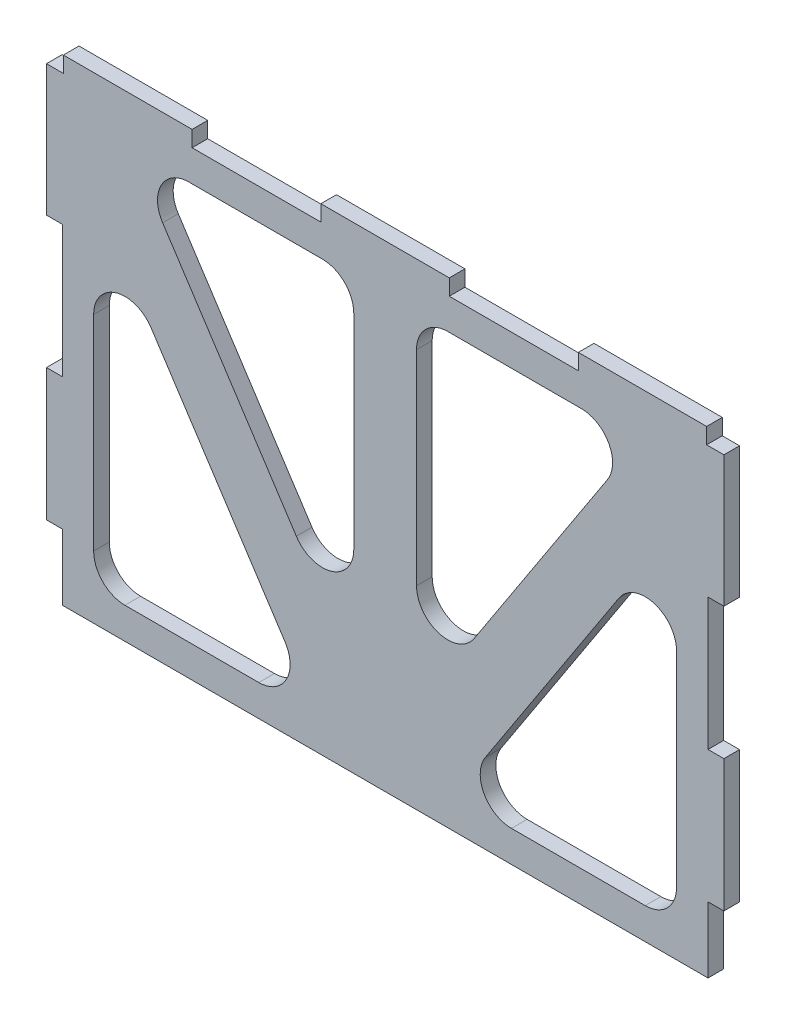
from build123d import *

# Parameters (mm, degrees)
BOSS_EXTRUDE1_DEPTH = 10


with BuildPart() as part:
    # Sketch1 → Boss-Extrude1 (new body)
    with BuildSketch(Plane.XY):
        Polygon((-237.234601608, -129.63585579), (-237.234601608, -87.457773568), (-247.40109201, -87.457773568), (-247.40109201, -3.101609123), (-237.234601608, -3.101609123), (-237.234601608, 81.254555321), (-247.40109201, 81.254555321), (-247.40109201, 165.110720504), (-236.605829759, 165.110720504), (-236.605829759, 175.291552649), (-154.294832327, 175.291552649), (-154.294832327, 165.110720504), (-71.987006932, 165.110720504), (-71.987006932, 175.291552649), (10.110681918, 175.291552649), (10.110681918, 165.110720504), (92.609794057, 165.110720504), (92.609794057, 175.291552649), (174.626730953, 175.291552649), (174.626730953, 165.110720504), (185.669445552, 165.110720504), (185.669445552, 81.254555321), (175.502955151, 81.254555321), (175.502955151, -3.101609123), (185.669445552, -3.101609123), (185.669445552, -87.457773568), (175.502955151, -87.457773568), (175.502955151, -129.63585579), align=None)
        with BuildLine():
            Line((-50.938162507, 125.110720504), (-50.938162507, -5.688963776))
            ThreePointArc((-50.938162507, -5.688963776), (-65.231084294, -24.857408112), (-87.681088334, -16.62854488))
            Line((-87.681088334, -16.62854488), (-173.143675307, 114.1711394))
            ThreePointArc((-173.143675307, 114.1711394), (-173.99040016, 134.629343774), (-156.400749479, 145.110720504))
            Line((-156.400749479, 145.110720504), (-70.938162507, 145.110720504))
            ThreePointArc((-70.938162507, 145.110720504), (-56.796026883, 139.252856128), (-50.938162507, 125.110720504))
        make_face(mode=Mode.SUBTRACT)
        with BuildLine():
            Line((-217.234601608, 41.348661081), (-217.234601608, -89.63585579))
            ThreePointArc((-217.234601608, -89.63585579), (-211.376737232, -103.777991414), (-197.234601608, -109.63585579))
            Line((-197.234601608, -109.63585579), (-111.651247744, -109.63585579))
            ThreePointArc((-111.651247744, -109.63585579), (-94.061597063, -99.15447906), (-94.908321917, -78.696274685))
            Line((-94.908321917, -78.696274685), (-180.491675781, 52.288242186))
            ThreePointArc((-180.491675781, 52.288242186), (-202.941679822, 60.517105417), (-217.234601608, 41.348661081))
        make_face(mode=Mode.SUBTRACT)
        with BuildLine():
            Line((-10.820423043, 125.110720504), (-10.820423043, -5.621130667))
            ThreePointArc((-10.820423043, -5.621130667), (3.47704632, -24.79092838), (25.92769139, -16.552766545))
            Line((25.92769139, -16.552766545), (111.257475845, 114.179084627))
            ThreePointArc((111.257475845, 114.179084627), (112.096753452, 134.633516377), (94.509361412, 145.110720504))
            Line((94.509361412, 145.110720504), (9.179576957, 145.110720504))
            ThreePointArc((9.179576957, 145.110720504), (-4.962558666, 139.252856128), (-10.820423043, 125.110720504))
        make_face(mode=Mode.SUBTRACT)
        with BuildLine():
            Line((118.641820815, 52.310380527), (33.137535964, -78.688818793))
            ThreePointArc((33.137535964, -78.688818793), (32.297563362, -99.141966865), (49.882730912, -109.620454457))
            Line((49.882730912, -109.620454457), (135.387015764, -109.632935879))
            ThreePointArc((135.387015764, -109.632935879), (149.53103864, -103.776103872), (155.389935248, -89.632936092))
            Line((155.389935248, -89.632936092), (155.389935248, 41.37874465))
            ThreePointArc((155.389935248, 41.37874465), (141.092465886, 60.548542362), (118.641820815, 52.310380527))
        make_face(mode=Mode.SUBTRACT)
    extrude(amount=BOSS_EXTRUDE1_DEPTH)


solid = part.part
